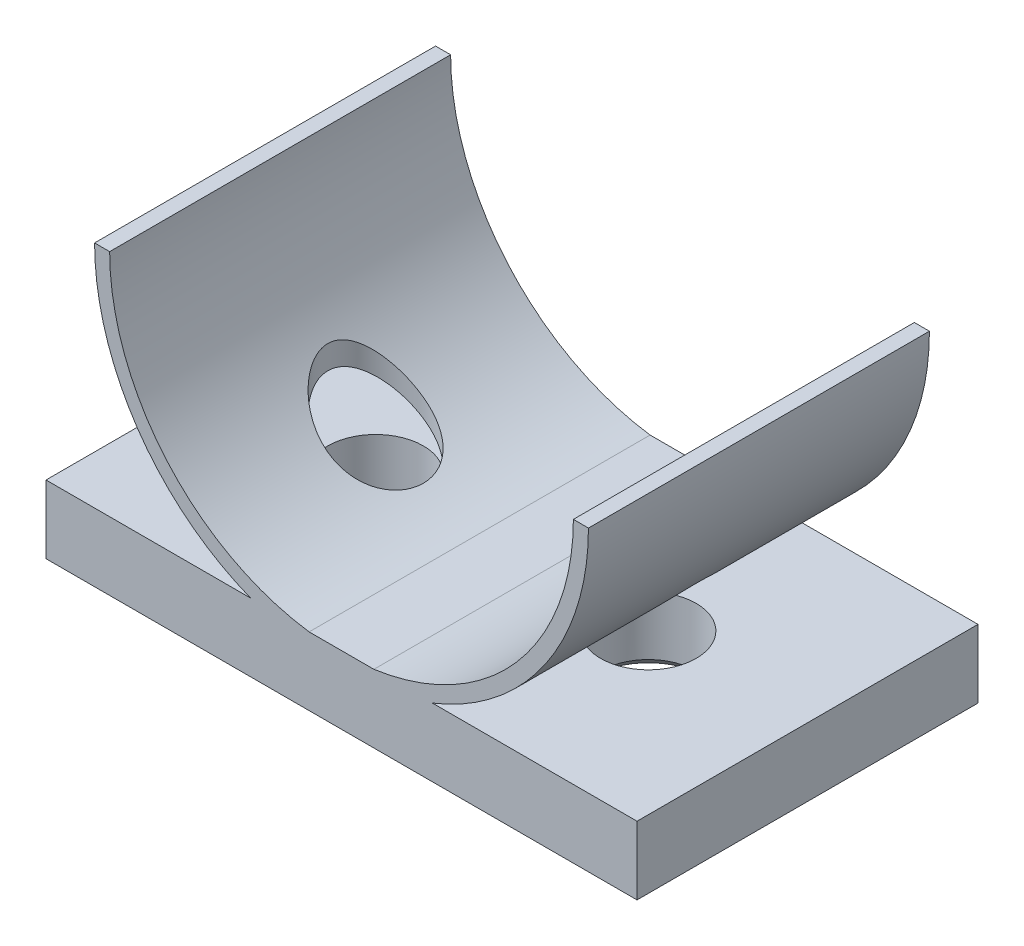
from build123d import *

# Parameters (mm, degrees)
SKETCH_1_W                   = 26
SKETCH_1_H                   = 15
EXTRUDE_1_DEPTH              = 3
EXTRUDE_2_DEPTH              = 15
HOLE_WIZARD_M5_2_D           = 4.2
HOLE_WIZARD_M5_2_DEPTH       = 12.4
HOLE_WIZARD_M5_2_CSINK_D     = 5.05
HOLE_WIZARD_M5_2_CSINK_ANGLE = 90
HOLE_WIZARD_M5_2_TIP         = 1.2618073


with BuildPart() as part:
    # 草图1 → 凸台-拉伸1 (new body)
    with BuildSketch(Plane(origin=(0, 0, 0), x_dir=(1, 0, 0), z_dir=(0, 1, 0))):
        with Locations((13, 7.5)):
            Rectangle(SKETCH_1_W, SKETCH_1_H)
    extrude(amount=EXTRUDE_1_DEPTH)

    # 草图3 → 凸台-拉伸2 (add)
    with BuildSketch(Plane.XY):
        with BuildLine():
            Line((9.001058493, 3), (11.575219315, 3))
            ThreePointArc((11.575219315, 3), (5.300234972, 6.410185465), (2.8, 13.1))
            Line((2.8, 13.1), (2.137148939, 13.1))
            ThreePointArc((2.137148939, 13.1), (4.015528976, 6.994198366), (9.001058493, 3))
        make_face()
        with BuildLine():
            Line((23.2, 13.1), (23.862851061, 13.1))
            ThreePointArc((23.862851061, 13.1), (21.984471024, 6.994198366), (16.998941507, 3))
            Line((16.998941507, 3), (14.424780685, 3))
            ThreePointArc((14.424780685, 3), (20.699765028, 6.410185465), (23.2, 13.1))
        make_face()
    extrude(amount=-EXTRUDE_2_DEPTH)

    # M5 螺纹孔2
    with Locations(Plane.XZ):
        with Locations((7, -7.5), (19, -7.5)):
            CounterSinkHole(HOLE_WIZARD_M5_2_D / 2, HOLE_WIZARD_M5_2_CSINK_D / 2, depth=HOLE_WIZARD_M5_2_DEPTH, counter_sink_angle=HOLE_WIZARD_M5_2_CSINK_ANGLE)
            with Locations((0, 0, -(HOLE_WIZARD_M5_2_DEPTH + HOLE_WIZARD_M5_2_TIP / 2))):  # 118° drill point
                Cone(0, HOLE_WIZARD_M5_2_D / 2, HOLE_WIZARD_M5_2_TIP, mode=Mode.SUBTRACT)


solid = part.part
